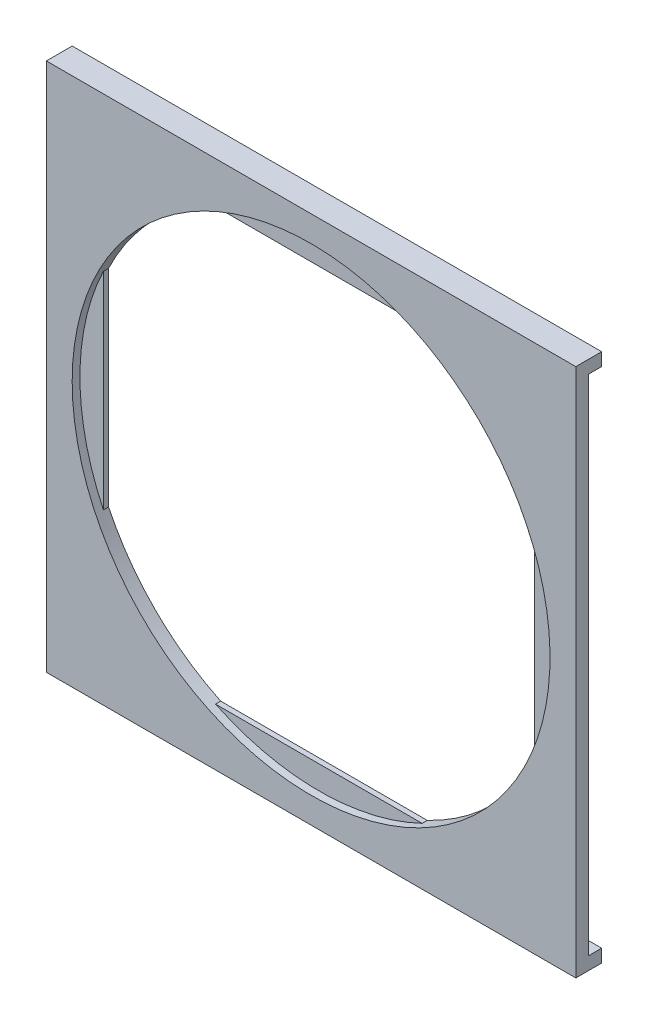
from build123d import *

# Parameters (mm, degrees)
SKETCH_7_W               = 400
SKETCH_7_H               = 400
EXTRUDE_1_DEPTH          = 3
SKETCH_8_W               = 380
SKETCH_8_H               = 2
EXTRUDE_2_DEPTH          = 140
SKETCH_9_W               = 2
SKETCH_9_H               = 382
EXTRUDE_3_DEPTH          = 140
PATTERN_LINEAR_1_COUNT   = 12
PATTERN_LINEAR_1_PITCH   = 30
PATTERN_LINEAR_3_COUNT   = 12
PATTERN_LINEAR_3_PITCH   = 30
SKETCH_11_W              = 400
SKETCH_11_H              = 400
CUT_EXTRUDE_1_DEPTH      = 3
CUT_EXTRUDE_2_DEPTH      = 570.034269618
CUT_EXTRUDE_2_DEPTH_BACK = 570.034269618
SKETCH_12_R              = 300
SKETCH_12_R_2            = 90
SKETCH_13_R              = 92.5
SKETCH_13_R_2            = 89.5
EXTRUDE_8_DEPTH          = 140
SKETCH_14_W              = 205
SKETCH_14_H              = 205
SKETCH_14_W_2            = 185
SKETCH_14_H_2            = 185
EXTRUDE_9_DEPTH          = 5
EXTRUDE_10_DEPTH         = 2
PATTERN_CIRCULAR_1_COUNT = 4
CUT_EXTRUDE_START        = -140
SKETCH_16_R              = 92.5
CUT_EXTRUDE_3_DEPTH      = 140
SKETCH_17_W              = 205
SKETCH_17_H              = 5
EXTRUDE_11_DEPTH         = 5


with BuildPart() as part:
    # 草图7 → 凸台-拉伸1 (new body)
    with BuildSketch(Plane.XY):
        with Locations((200, 200)):
            Rectangle(SKETCH_7_W, SKETCH_7_H)
    extrude(amount=EXTRUDE_1_DEPTH)

    # 草图8 → 凸台-拉伸2 (add)
    with BuildSketch(Plane.XY.offset(3)):
        with Locations((200, 389)):
            Rectangle(SKETCH_8_W, SKETCH_8_H)
    extrude_2 = extrude(amount=EXTRUDE_2_DEPTH)

    # 草图9 → 凸台-拉伸3 (add)
    with BuildSketch(Plane.XY.offset(3)):
        with Locations((11, 199)):
            Rectangle(SKETCH_9_W, SKETCH_9_H)
    extrude_3 = extrude(amount=EXTRUDE_3_DEPTH)

    # 阵列(线性)1: 凸台-拉伸3 ×12
    with Locations(*[(i * PATTERN_LINEAR_1_PITCH, 0, 0) for i in range(1, PATTERN_LINEAR_1_COUNT)]):
        add(extrude_3)

    # 阵列(线性)3: 凸台-拉伸2 ×12
    with Locations(*[(0, -i * PATTERN_LINEAR_3_PITCH, 0) for i in range(1, PATTERN_LINEAR_3_COUNT)]):
        add(extrude_2)

    # 草图11 → 切除-拉伸1 (cut)
    with BuildSketch(Plane(origin=(0, 0, 0), x_dir=(-1, 0, 0), z_dir=(0, 0, -1))):
        with Locations((-200, 200)):
            Rectangle(SKETCH_11_W, SKETCH_11_H)
    extrude(amount=-CUT_EXTRUDE_1_DEPTH, mode=Mode.SUBTRACT)

    # 草图12 → 切除-拉伸2 (cut, two sides: drawn at the far end of the back side and taken through both)
    with BuildSketch(Plane(origin=(0, 0, 3), x_dir=(-1, 0, 0), z_dir=(0, 0, -1)).offset(-CUT_EXTRUDE_2_DEPTH_BACK)):
        with Locations((-191, 208.958405787)):
            Circle(SKETCH_12_R)
        with Locations((-191, 208.958405787)):
            Circle(SKETCH_12_R_2, mode=Mode.SUBTRACT)
    extrude(amount=CUT_EXTRUDE_2_DEPTH + CUT_EXTRUDE_2_DEPTH_BACK, mode=Mode.SUBTRACT)

    # 草图13 → 凸台-拉伸8 (add)
    with BuildSketch(Plane(origin=(0, 0, 3), x_dir=(-1, 0, 0), z_dir=(0, 0, -1))):
        with Locations((-191, 209)):
            Circle(SKETCH_13_R)
        with Locations((-191, 209)):
            Circle(SKETCH_13_R_2, mode=Mode.SUBTRACT)
    extrude(amount=-EXTRUDE_8_DEPTH)

    # 草图16 → 切除-拉伸3 (cut)
    with BuildSketch(Plane.XY.offset(143).offset(CUT_EXTRUDE_START)):
        with Locations(Location((191, 209, 0), (0, 0, 25.622027747))):
            Circle(SKETCH_16_R)
    extrude(amount=CUT_EXTRUDE_3_DEPTH, mode=Mode.SUBTRACT)


with BuildPart() as body_2:
    # 草图14 → 凸台-拉伸9 (new body)
    # profile 1 of 5: a face of its own
    with BuildSketch(Plane(origin=(0, 0, 3), x_dir=(-1, 0, 0), z_dir=(0, 0, -1))):
        with Locations((-191, 209)):
            Rectangle(SKETCH_14_W, SKETCH_14_H)
        with Locations((-191, 209)):
            Rectangle(SKETCH_14_W_2, SKETCH_14_H_2, mode=Mode.SUBTRACT)
    # profile 2 of 5: a face of its own
    with BuildSketch(Plane(origin=(0, 0, 3), x_dir=(-1, 0, 0), z_dir=(0, 0, -1))):
        with BuildLine():
            Line((-283.5, 209), (-283.5, 116.5))
            Line((-283.5, 116.5), (-191, 116.5))
            ThreePointArc((-191, 116.5), (-256.40737726, 143.59262274), (-283.5, 209))
        make_face()
    # profile 3 of 5: a face of its own
    with BuildSketch(Plane(origin=(0, 0, 3), x_dir=(-1, 0, 0), z_dir=(0, 0, -1))):
        with BuildLine():
            Line((-283.5, 301.5), (-283.5, 209))
            ThreePointArc((-283.5, 209), (-256.40737726, 274.40737726), (-191, 301.5))
            Line((-191, 301.5), (-283.5, 301.5))
        make_face()
    # profile 4 of 5: a face of its own
    with BuildSketch(Plane(origin=(0, 0, 3), x_dir=(-1, 0, 0), z_dir=(0, 0, -1))):
        with BuildLine():
            Line((-98.5, 301.5), (-191, 301.5))
            ThreePointArc((-191, 301.5), (-125.59262274, 274.40737726), (-98.5, 209))
            Line((-98.5, 209), (-98.5, 301.5))
        make_face()
    # profile 5 of 5: a face of its own
    with BuildSketch(Plane(origin=(0, 0, 3), x_dir=(-1, 0, 0), z_dir=(0, 0, -1))):
        with BuildLine():
            ThreePointArc((-98.5, 209), (-125.59262274, 143.59262274), (-191, 116.5))
            Line((-191, 116.5), (-98.5, 116.5))
            Line((-98.5, 116.5), (-98.5, 209))
        make_face()
    extrude(amount=EXTRUDE_9_DEPTH)

    # 草图15 → 凸台-拉伸10 (add)
    with BuildSketch(Plane(origin=(0, 0, -2), x_dir=(-1, 0, 0), z_dir=(0, 0, -1))):
        with BuildLine():
            Line((-231, 292.404136588), (-151, 292.404136588))
            ThreePointArc((-151, 292.404136588), (-191, 301.5), (-231, 292.404136588))
        make_face()
    extrude_10 = extrude(amount=-EXTRUDE_10_DEPTH)

    # 阵列(圆周)1: 凸台-拉伸10 ×4 about axis
    pattern_circular_1_axis = Axis((191, 209, 0), (0, 0, 1))
    for i in range(1, PATTERN_CIRCULAR_1_COUNT):
        add(extrude_10.rotate(pattern_circular_1_axis, i * 360 / PATTERN_CIRCULAR_1_COUNT))

    # 草图17 → 凸台-拉伸11 (add)
    with BuildSketch(Plane(origin=(0, 0, -2), x_dir=(-1, 0, 0), z_dir=(0, 0, -1))):
        with Locations((-191, 309)):
            Rectangle(SKETCH_17_W, SKETCH_17_H)
        with Locations((-191, 109)):
            Rectangle(SKETCH_17_W, SKETCH_17_H)
    extrude(amount=EXTRUDE_11_DEPTH)


solid = body_2.part
